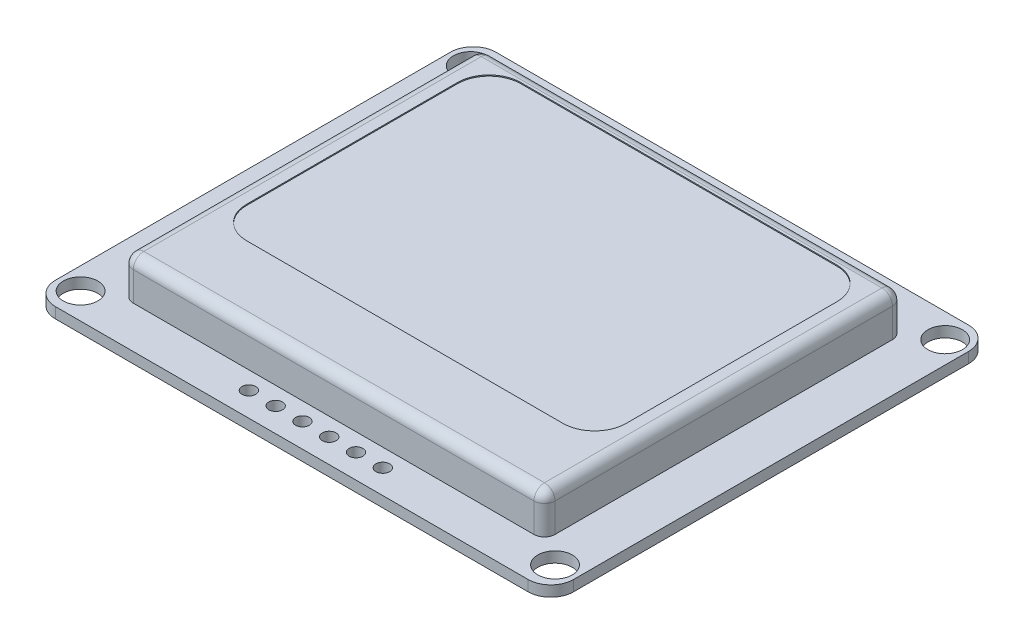
from build123d import *

# Parameters (mm, degrees)
SKETCH2_W           = 40
SKETCH2_H           = 34
BOSS_EXTRUDE1_DEPTH = 3.75
SKETCH3_W           = 49.149
SKETCH3_H           = 41.783
BOSS_EXTRUDE2_DEPTH = 1.016
CUT_EXTRUDE1_REACH  = 34.524
SKETCH4_R           = 1.6383
FILLET1_R           = 2.159
CUT_EXTRUDE2_REACH  = 34.524
SKETCH5_R           = 0.649719702
SKETCH6_W           = 36
SKETCH6_H           = 26
CUT_EXTRUDE3_DEPTH  = 0.1016
FILLET2_R           = 3
FILLET3_R           = 1
FILLET4_R           = 1


with BuildPart() as part:
    # Sketch2 → Boss-Extrude1 (new body)
    with BuildSketch(Plane(origin=(0, 0, 0), x_dir=(1, 0, 0), z_dir=(0, 1, 0))):
        Rectangle(SKETCH2_W, SKETCH2_H)
    extrude(amount=BOSS_EXTRUDE1_DEPTH)

    # Sketch3 → Boss-Extrude2 (add)
    with BuildSketch(Plane(origin=(0, 0, 0), x_dir=(1, 0, 0), z_dir=(0, 1, 0))):
        with Locations((0, -0.0815)):
            Rectangle(SKETCH3_W, SKETCH3_H)
    extrude(amount=-BOSS_EXTRUDE2_DEPTH)

    # Sketch4 → Cut-Extrude1 (cut, up to next)
    with BuildSketch(Plane(origin=(0, 0, 0), x_dir=(1, 0, 0), z_dir=(0, 1, 0)), mode=Mode.PRIVATE) as cut_extrude1_sk1:
        with Locations(Location((-22.5, 18.5, 0), (0, 0, 270))):
            Circle(SKETCH4_R)
    cut_extrude1_tool1 = extrude(cut_extrude1_sk1.sketch, amount=-CUT_EXTRUDE1_REACH, mode=Mode.PRIVATE) & part.part
    # Sketch4 → Cut-Extrude1 (cut, up to next)
    with BuildSketch(Plane(origin=(0, 0, 0), x_dir=(1, 0, 0), z_dir=(0, 1, 0)), mode=Mode.PRIVATE) as cut_extrude1_sk2:
        with Locations(Location((-22.5, -18.5, 0), (0, 0, 270))):
            Circle(SKETCH4_R)
    cut_extrude1_tool2 = extrude(cut_extrude1_sk2.sketch, amount=-CUT_EXTRUDE1_REACH, mode=Mode.PRIVATE) & part.part
    # Sketch4 → Cut-Extrude1 (cut, up to next)
    with BuildSketch(Plane(origin=(0, 0, 0), x_dir=(1, 0, 0), z_dir=(0, 1, 0)), mode=Mode.PRIVATE) as cut_extrude1_sk3:
        with Locations(Location((22.5, 18.5, 0), (0, 0, 270))):
            Circle(SKETCH4_R)
    cut_extrude1_tool3 = extrude(cut_extrude1_sk3.sketch, amount=-CUT_EXTRUDE1_REACH, mode=Mode.PRIVATE) & part.part
    # Sketch4 → Cut-Extrude1 (cut, up to next)
    with BuildSketch(Plane(origin=(0, 0, 0), x_dir=(1, 0, 0), z_dir=(0, 1, 0)), mode=Mode.PRIVATE) as cut_extrude1_sk4:
        with Locations(Location((22.5, -18.5, 0), (0, 0, 270))):
            Circle(SKETCH4_R)
    cut_extrude1_tool4 = extrude(cut_extrude1_sk4.sketch, amount=-CUT_EXTRUDE1_REACH, mode=Mode.PRIVATE) & part.part
    add(cut_extrude1_tool1.solids().sort_by_distance((-22.5, 0, -18.5))[0], mode=Mode.SUBTRACT)
    add(cut_extrude1_tool2.solids().sort_by_distance((-22.5, 0, 18.5))[0], mode=Mode.SUBTRACT)
    add(cut_extrude1_tool3.solids().sort_by_distance((22.5, 0, -18.5))[0], mode=Mode.SUBTRACT)
    add(cut_extrude1_tool4.solids().sort_by_distance((22.5, 0, 18.5))[0], mode=Mode.SUBTRACT)

    # Fillet1
    fillet1_edges = [part.edges().sort_by_distance(p)[0] for p in [
        (-24.5745, -0.508, 20.973),
        (-24.5745, -0.508, -20.81),
        (24.5745, -0.508, -20.81),
        (24.5745, -0.508, 20.973),
    ]]
    fillet(fillet1_edges, radius=FILLET1_R)

    # Sketch5 → Cut-Extrude2 (cut, up to next)
    with BuildSketch(Plane(origin=(0, 0, 0), x_dir=(1, 0, 0), z_dir=(0, 1, 0)), mode=Mode.PRIVATE) as cut_extrude2_sk1:
        with Locations(Location((-1.27, 19.2225, 0), (0, 0, 270))):
            Circle(SKETCH5_R)
    cut_extrude2_tool1 = extrude(cut_extrude2_sk1.sketch, amount=-CUT_EXTRUDE2_REACH, mode=Mode.PRIVATE) & part.part
    # Sketch5 → Cut-Extrude2 (cut, up to next)
    with BuildSketch(Plane(origin=(0, 0, 0), x_dir=(1, 0, 0), z_dir=(0, 1, 0)), mode=Mode.PRIVATE) as cut_extrude2_sk2:
        with Locations(Location((-3.81, 19.2225, 0), (0, 0, 270))):
            Circle(SKETCH5_R)
    cut_extrude2_tool2 = extrude(cut_extrude2_sk2.sketch, amount=-CUT_EXTRUDE2_REACH, mode=Mode.PRIVATE) & part.part
    # Sketch5 → Cut-Extrude2 (cut, up to next)
    with BuildSketch(Plane(origin=(0, 0, 0), x_dir=(1, 0, 0), z_dir=(0, 1, 0)), mode=Mode.PRIVATE) as cut_extrude2_sk3:
        with Locations(Location((-6.35, 19.2225, 0), (0, 0, 270))):
            Circle(SKETCH5_R)
    cut_extrude2_tool3 = extrude(cut_extrude2_sk3.sketch, amount=-CUT_EXTRUDE2_REACH, mode=Mode.PRIVATE) & part.part
    # Sketch5 → Cut-Extrude2 (cut, up to next)
    with BuildSketch(Plane(origin=(0, 0, 0), x_dir=(1, 0, 0), z_dir=(0, 1, 0)), mode=Mode.PRIVATE) as cut_extrude2_sk4:
        with Locations(Location((1.27, 19.2225, 0), (0, 0, 270))):
            Circle(SKETCH5_R)
    cut_extrude2_tool4 = extrude(cut_extrude2_sk4.sketch, amount=-CUT_EXTRUDE2_REACH, mode=Mode.PRIVATE) & part.part
    # Sketch5 → Cut-Extrude2 (cut, up to next)
    with BuildSketch(Plane(origin=(0, 0, 0), x_dir=(1, 0, 0), z_dir=(0, 1, 0)), mode=Mode.PRIVATE) as cut_extrude2_sk5:
        with Locations(Location((3.81, 19.2225, 0), (0, 0, 270))):
            Circle(SKETCH5_R)
    cut_extrude2_tool5 = extrude(cut_extrude2_sk5.sketch, amount=-CUT_EXTRUDE2_REACH, mode=Mode.PRIVATE) & part.part
    # Sketch5 → Cut-Extrude2 (cut, up to next)
    with BuildSketch(Plane(origin=(0, 0, 0), x_dir=(1, 0, 0), z_dir=(0, 1, 0)), mode=Mode.PRIVATE) as cut_extrude2_sk6:
        with Locations(Location((6.35, 19.2225, 0), (0, 0, 270))):
            Circle(SKETCH5_R)
    cut_extrude2_tool6 = extrude(cut_extrude2_sk6.sketch, amount=-CUT_EXTRUDE2_REACH, mode=Mode.PRIVATE) & part.part
    # Sketch5 → Cut-Extrude2 (cut, up to next)
    with BuildSketch(Plane(origin=(0, 0, 0), x_dir=(1, 0, 0), z_dir=(0, 1, 0)), mode=Mode.PRIVATE) as cut_extrude2_sk7:
        with Locations(Location((6.35, -18.687, 0), (0, 0, 90))):
            Circle(SKETCH5_R)
    cut_extrude2_tool7 = extrude(cut_extrude2_sk7.sketch, amount=-CUT_EXTRUDE2_REACH, mode=Mode.PRIVATE) & part.part
    # Sketch5 → Cut-Extrude2 (cut, up to next)
    with BuildSketch(Plane(origin=(0, 0, 0), x_dir=(1, 0, 0), z_dir=(0, 1, 0)), mode=Mode.PRIVATE) as cut_extrude2_sk8:
        with Locations(Location((3.81, -18.687, 0), (0, 0, 90))):
            Circle(SKETCH5_R)
    cut_extrude2_tool8 = extrude(cut_extrude2_sk8.sketch, amount=-CUT_EXTRUDE2_REACH, mode=Mode.PRIVATE) & part.part
    # Sketch5 → Cut-Extrude2 (cut, up to next)
    with BuildSketch(Plane(origin=(0, 0, 0), x_dir=(1, 0, 0), z_dir=(0, 1, 0)), mode=Mode.PRIVATE) as cut_extrude2_sk9:
        with Locations(Location((1.27, -18.687, 0), (0, 0, 90))):
            Circle(SKETCH5_R)
    cut_extrude2_tool9 = extrude(cut_extrude2_sk9.sketch, amount=-CUT_EXTRUDE2_REACH, mode=Mode.PRIVATE) & part.part
    # Sketch5 → Cut-Extrude2 (cut, up to next)
    with BuildSketch(Plane(origin=(0, 0, 0), x_dir=(1, 0, 0), z_dir=(0, 1, 0)), mode=Mode.PRIVATE) as cut_extrude2_sk10:
        with Locations(Location((-6.35, -18.687, 0), (0, 0, 90))):
            Circle(SKETCH5_R)
    cut_extrude2_tool10 = extrude(cut_extrude2_sk10.sketch, amount=-CUT_EXTRUDE2_REACH, mode=Mode.PRIVATE) & part.part
    # Sketch5 → Cut-Extrude2 (cut, up to next)
    with BuildSketch(Plane(origin=(0, 0, 0), x_dir=(1, 0, 0), z_dir=(0, 1, 0)), mode=Mode.PRIVATE) as cut_extrude2_sk11:
        with Locations(Location((-3.81, -18.687, 0), (0, 0, 90))):
            Circle(SKETCH5_R)
    cut_extrude2_tool11 = extrude(cut_extrude2_sk11.sketch, amount=-CUT_EXTRUDE2_REACH, mode=Mode.PRIVATE) & part.part
    # Sketch5 → Cut-Extrude2 (cut, up to next)
    with BuildSketch(Plane(origin=(0, 0, 0), x_dir=(1, 0, 0), z_dir=(0, 1, 0)), mode=Mode.PRIVATE) as cut_extrude2_sk12:
        with Locations(Location((-1.27, -18.687, 0), (0, 0, 90))):
            Circle(SKETCH5_R)
    cut_extrude2_tool12 = extrude(cut_extrude2_sk12.sketch, amount=-CUT_EXTRUDE2_REACH, mode=Mode.PRIVATE) & part.part
    add(cut_extrude2_tool1.solids().sort_by_distance((-1.27, 0, -19.2225))[0], mode=Mode.SUBTRACT)
    add(cut_extrude2_tool2.solids().sort_by_distance((-3.81, 0, -19.2225))[0], mode=Mode.SUBTRACT)
    add(cut_extrude2_tool3.solids().sort_by_distance((-6.35, 0, -19.2225))[0], mode=Mode.SUBTRACT)
    add(cut_extrude2_tool4.solids().sort_by_distance((1.27, 0, -19.2225))[0], mode=Mode.SUBTRACT)
    add(cut_extrude2_tool5.solids().sort_by_distance((3.81, 0, -19.2225))[0], mode=Mode.SUBTRACT)
    add(cut_extrude2_tool6.solids().sort_by_distance((6.35, 0, -19.2225))[0], mode=Mode.SUBTRACT)
    add(cut_extrude2_tool7.solids().sort_by_distance((6.35, 0, 18.687))[0], mode=Mode.SUBTRACT)
    add(cut_extrude2_tool8.solids().sort_by_distance((3.81, 0, 18.687))[0], mode=Mode.SUBTRACT)
    add(cut_extrude2_tool9.solids().sort_by_distance((1.27, 0, 18.687))[0], mode=Mode.SUBTRACT)
    add(cut_extrude2_tool10.solids().sort_by_distance((-6.35, 0, 18.687))[0], mode=Mode.SUBTRACT)
    add(cut_extrude2_tool11.solids().sort_by_distance((-3.81, 0, 18.687))[0], mode=Mode.SUBTRACT)
    add(cut_extrude2_tool12.solids().sort_by_distance((-1.27, 0, 18.687))[0], mode=Mode.SUBTRACT)

    # Sketch6 → Cut-Extrude3 (cut)
    with BuildSketch(Plane(origin=(0, 3.75, 0), x_dir=(1, 0, 0), z_dir=(0, 1, 0))):
        with Locations((0, 2.75)):
            Rectangle(SKETCH6_W, SKETCH6_H)
    extrude(amount=-CUT_EXTRUDE3_DEPTH, mode=Mode.SUBTRACT)

    # Fillet2
    fillet2_edges = [part.edges().sort_by_distance(p)[0] for p in [
        (-18, 3.6992, 10.25),
        (-18, 3.6992, -15.75),
        (18, 3.6992, -15.75),
        (18, 3.6992, 10.25),
    ]]
    fillet(fillet2_edges, radius=FILLET2_R)

    # Fillet3
    fillet3_edges = [part.edges().sort_by_distance(p)[0] for p in [
        (-20, 1.875, -17),
        (20, 1.875, -17),
        (20, 1.875, 17),
        (-20, 1.875, 17),
    ]]
    fillet(fillet3_edges, radius=FILLET3_R)

    # Fillet4
    fillet4_edges = [part.edges().sort_by_distance(p)[0] for p in [
        (-20, 3.75, 0),
        (0, 3.75, -17),
        (0, 3.75, 17),
        (20, 3.75, 0),
        (19.707106781, 3.75, -16.707106781),
        (19.707106781, 3.75, 16.707106781),
        (-19.707106781, 3.75, 16.707106781),
        (-19.707106781, 3.75, -16.707106781),
    ]]
    fillet(fillet4_edges, radius=FILLET4_R)


solid = part.part
